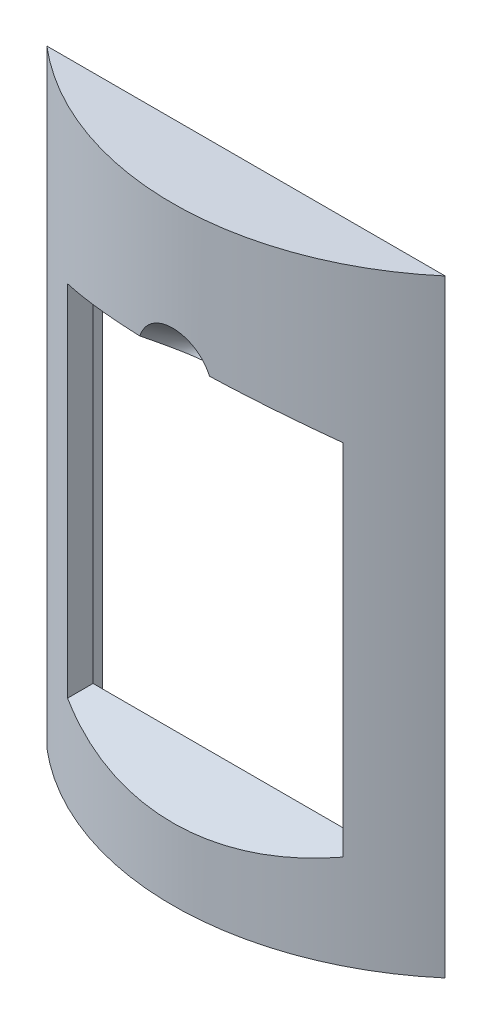
from build123d import *

# Parameters (mm, degrees)
BOSS_EXTRUDE1_DEPTH = 290
SKETCH3_W           = 137
SKETCH3_H           = 57.4
SKETCH3_W_2         = 56
SKETCH3_H_2         = 30.6
BOSS_EXTRUDE2_DEPTH = 12.30416804
SKETCH3_3_W         = 121.3
SKETCH3_3_H         = 161.2
CUT_EXTRUDE1_DEPTH  = 307.006700561
CUT_EXTRUDE1_TAPER  = -35
SKETCH3_5_R         = 2
CUT_EXTRUDE2_DEPTH  = 307.006700694
CUT_EXTRUDE2_DRAFT  = 36
FILLET2_R           = 1


with BuildPart() as part:
    # Sketch1 → Boss-Extrude1 (new body)
    with BuildSketch(Plane(origin=(0, 0, 0), x_dir=(1, 0, 0), z_dir=(0, 1, 0))):
        with BuildLine():
            Line((0, 0), (-68.5, 0))
            Line((-68.5, 0), (-68.5, 7.5))
            Line((-68.5, 7.5), (-68.5, 12.30416804))
            Line((-68.5, 12.30416804), (-95, 12.30416804))
            ThreePointArc((-95, 12.30416804), (0, -22.69583196), (95, 12.30416804))
            Line((95, 12.30416804), (68.5, 12.30416804))
            Line((68.5, 12.30416804), (68.5, 7.5))
            Line((68.5, 7.5), (68.5, 0))
            Line((68.5, 0), (0, 0))
        make_face()
    extrude(amount=BOSS_EXTRUDE1_DEPTH)

    # Sketch3 → Boss-Extrude2 (add)
    with BuildSketch(Plane(origin=(0, 0, 0), x_dir=(-1, 0, 0), z_dir=(0, 0, -1))):
        with Locations((0, 261.3)):
            Rectangle(SKETCH3_W, SKETCH3_H)
        with Locations((-40.5, 15.3)):
            Rectangle(SKETCH3_W_2, SKETCH3_H_2)
        with Locations((40.5, 15.3)):
            Rectangle(SKETCH3_W_2, SKETCH3_H_2)
    extrude(amount=BOSS_EXTRUDE2_DEPTH)

    # Sketch3<3> → Cut-Extrude1 (cut, through all)
    with BuildSketch(Plane(origin=(0, 0, 0), x_dir=(-1, 0, 0), z_dir=(0, 0, -1))):
        with Locations((0, 130.6)):
            Rectangle(SKETCH3_3_W, SKETCH3_3_H)
    extrude(amount=-CUT_EXTRUDE1_DEPTH, taper=CUT_EXTRUDE1_TAPER, mode=Mode.SUBTRACT)


with BuildPart() as cut_extrude2_tool:
    # Sketch3<5> → Cut-Extrude2 (with draft: the straight prism first)
    with BuildSketch(Plane(origin=(0, 0, 0), x_dir=(-1, 0, 0), z_dir=(0, 0, -1))):
        with Locations((0, 220)):
            Circle(SKETCH3_5_R)
    extrude(amount=-CUT_EXTRUDE2_DEPTH)
    # Cut-Extrude2: the draft: its side faces are tilted about the plane it starts from
    cut_extrude2_sides = [cut_extrude2_tool.faces().sort_by_distance(p)[0] for p in [
        (2, 220, 153.503350347),
    ]]
    draft(cut_extrude2_sides, Plane(origin=(0, 0, 0), x_dir=(-1, 0, 0), z_dir=(0, 0, -1)), CUT_EXTRUDE2_DRAFT)


with BuildPart() as part_1:
    add(part.part)

    # Cut-Extrude2: cut by cut_extrude2_tool
    add(cut_extrude2_tool.part, mode=Mode.SUBTRACT)

    # Fillet2
    fillet2_edges = [part_1.edges().sort_by_distance(p)[0] for p in [
        (2, 220, 0),
    ]]
    fillet(fillet2_edges, radius=FILLET2_R)


solid = part_1.part
